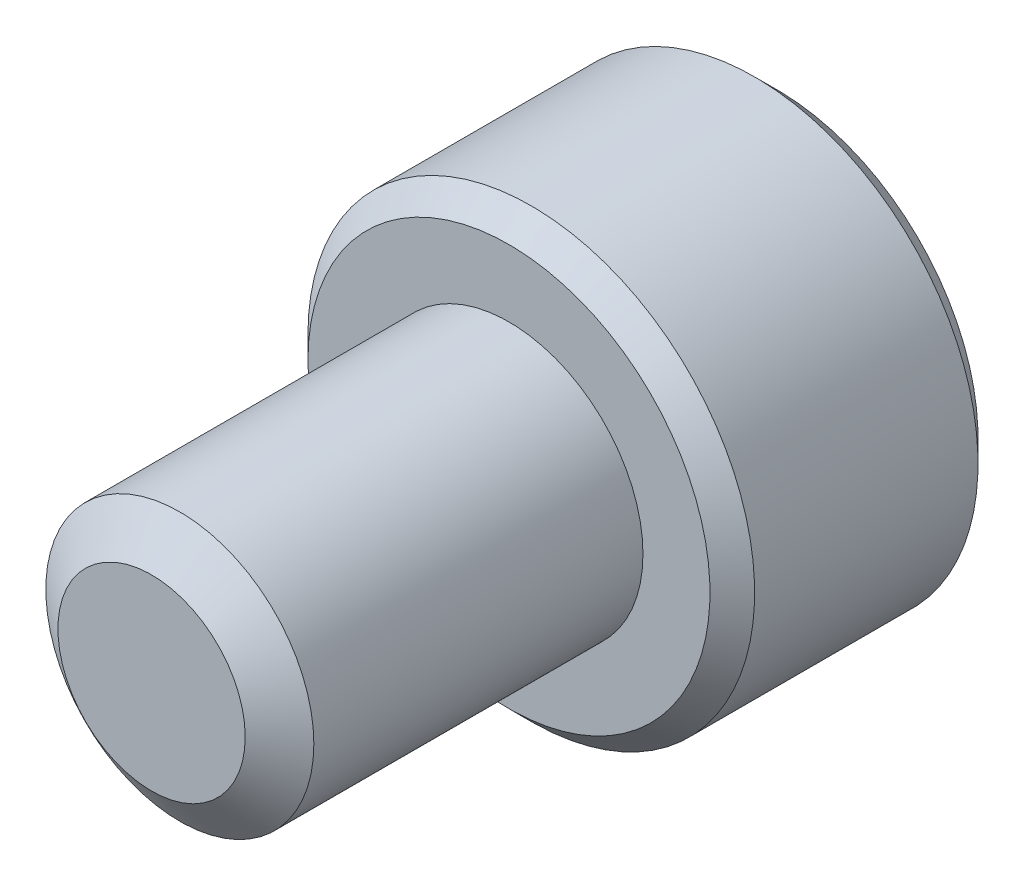
from build123d import *

# Parameters (mm, degrees)
SKETCH1_R          = 3
EXTRUDE1_DEPTH     = 8
SKETCH6_R          = 5
EXTRUDE2_DEPTH     = 6
CUT_EXTRUDE1_DEPTH = 3.75
CHAMFER1_SIZE      = 0.5


with BuildPart() as part:
    # Sketch1 → Extrude1 (new body)
    with BuildSketch(Plane.XY):
        Circle(SKETCH1_R)
    extrude(amount=-EXTRUDE1_DEPTH)

    # Sketch4 → Cut-Revolve1 (revolve, cut)
    with BuildSketch(Plane(origin=(0, 0, 0), x_dir=(0, 0, -1), z_dir=(1, 0, 0))):
        Polygon((0.632650852, 3), (0, 2.096480947), (0, 3), align=None)
    revolve(axis=Axis((0, 0, 0), (0, 0, -1)), mode=Mode.SUBTRACT)

    # Sketch6 → Extrude2 (add)
    with BuildSketch(Plane(origin=(0, 0, -8), x_dir=(-1, 0, 0), z_dir=(0, 0, -1))):
        Circle(SKETCH6_R)
    extrude(amount=EXTRUDE2_DEPTH)

    # Sketch7 → Cut-Extrude1 (cut)
    with BuildSketch(Plane(origin=(0, 0, -14), x_dir=(-1, 0, 0), z_dir=(0, 0, -1))):
        Polygon((0, 2.886751346), (-2.5, 1.443375673), (-2.5, -1.443375673), (0, -2.886751346), (2.5, -1.443375673), (2.5, 1.443375673), align=None)
    extrude(amount=-CUT_EXTRUDE1_DEPTH, mode=Mode.SUBTRACT)

    # Chamfer1
    chamfer1_edges = [part.edges().sort_by_distance(p)[0] for p in [
        (5, 0, -14),
        (5, 0, -8),
    ]]
    chamfer(chamfer1_edges, length=CHAMFER1_SIZE)


solid = part.part
